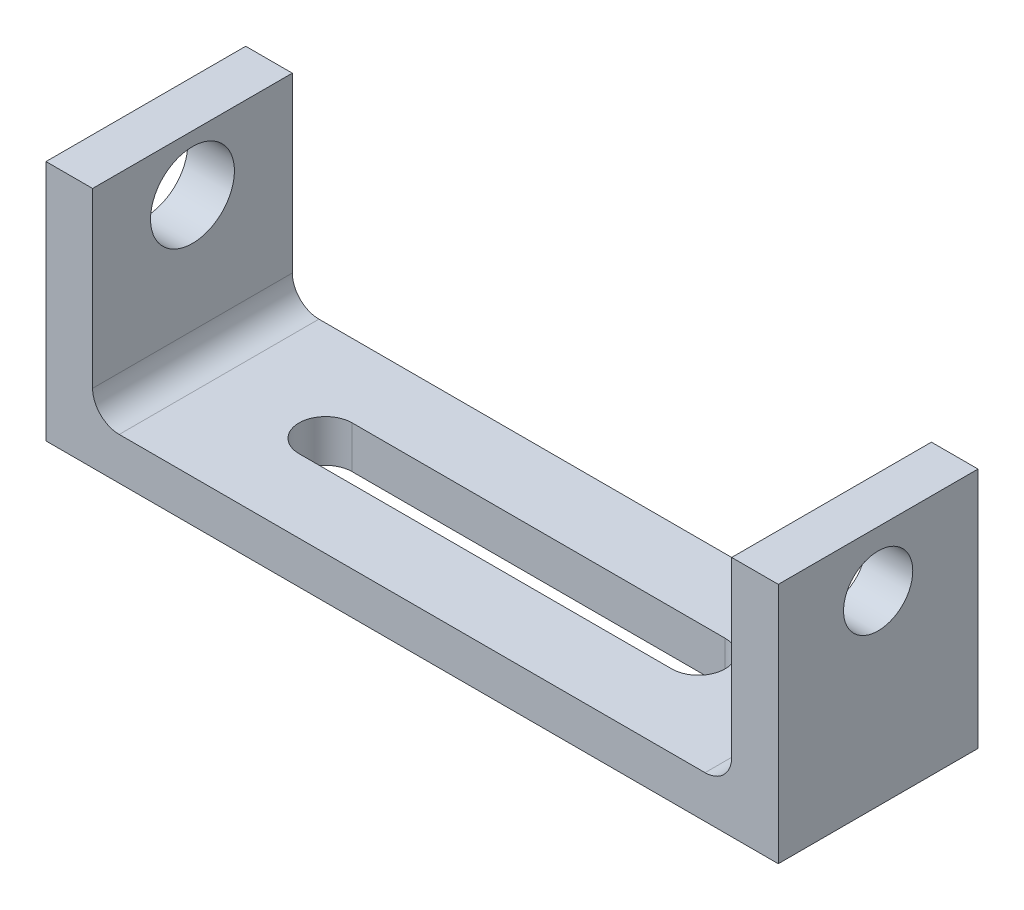
from build123d import *

# Parameters (mm, degrees)
SKETCH1_W           = 55
SKETCH1_H           = 15
BOSS_EXTRUDE1_DEPTH = 3.175
SKETCH2_W           = 3.5
SKETCH2_H           = 15
BOSS_EXTRUDE2_DEPTH = 15
FILLET1_R           = 2
CUT_EXTRUDE1_DEPTH  = 33.210246817
SKETCH4_R           = 2.6
CUT_EXTRUDE2_DEPTH  = 10
SKETCH5_R           = 3.15
CUT_EXTRUDE3_DEPTH  = 5


with BuildPart() as part:
    # Sketch1 → Boss-Extrude1 (new body)
    with BuildSketch(Plane(origin=(0, 0, 0), x_dir=(1, 0, 0), z_dir=(0, 1, 0))):
        Rectangle(SKETCH1_W, SKETCH1_H)
    extrude(amount=BOSS_EXTRUDE1_DEPTH)

    # Sketch2 → Boss-Extrude2 (add)
    with BuildSketch(Plane(origin=(0, 3.175, 0), x_dir=(1, 0, 0), z_dir=(0, 1, 0))):
        with Locations((-25.75, 0)):
            Rectangle(SKETCH2_W, SKETCH2_H)
        with Locations((25.75, 0)):
            Rectangle(SKETCH2_W, SKETCH2_H)
    extrude(amount=BOSS_EXTRUDE2_DEPTH)

    # Fillet1
    fillet1_edges = [part.edges().sort_by_distance(p)[0] for p in [
        (-24, 3.175, 0),
        (24, 3.175, 0),
    ]]
    fillet(fillet1_edges, radius=FILLET1_R)

    # Sketch3 → Cut-Extrude1 (cut, through all)
    with BuildSketch(Plane(origin=(0, 3.175, 0), x_dir=(1, 0, 0), z_dir=(0, 1, 0))):
        with BuildLine():
            Line((-14, 2), (14, 2))
            ThreePointArc((14, 2), (16, 0), (14, -2))
            Line((14, -2), (-14, -2))
            ThreePointArc((-14, -2), (-16, 0), (-14, 2))
        make_face()
    extrude(amount=-CUT_EXTRUDE1_DEPTH, mode=Mode.SUBTRACT)

    # Sketch4 → Cut-Extrude2 (cut)
    with BuildSketch(Plane(origin=(27.5, 0, 0), x_dir=(0, 0, -1), z_dir=(1, 0, 0))):
        with Locations((0, 14)):
            Circle(SKETCH4_R)
    extrude(amount=-CUT_EXTRUDE2_DEPTH, mode=Mode.SUBTRACT)

    # Sketch5 → Cut-Extrude3 (cut)
    with BuildSketch(Plane.ZY.offset(27.5)):
        with Locations((0, 14)):
            Circle(SKETCH5_R)
    extrude(amount=-CUT_EXTRUDE3_DEPTH, mode=Mode.SUBTRACT)


solid = part.part
